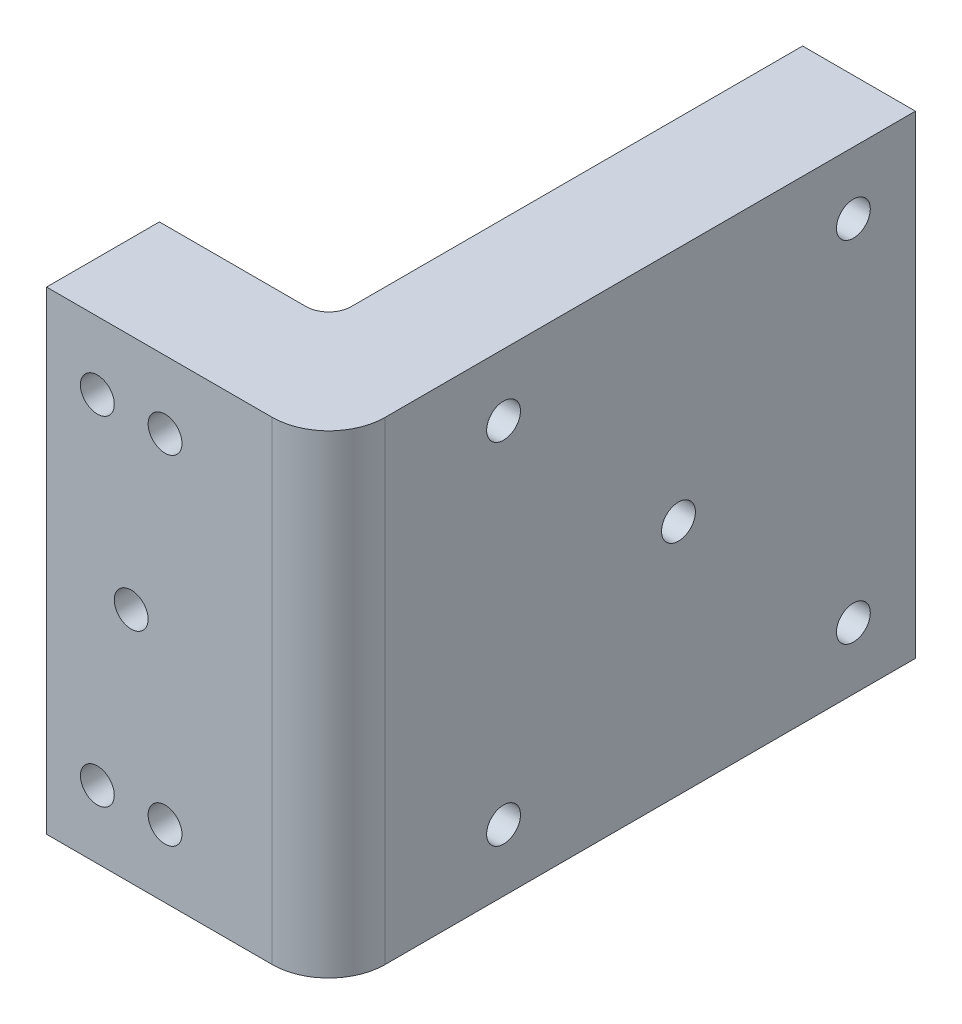
from build123d import *

# Parameters (mm, degrees)
SKETCH_1_W          = 15
SKETCH_1_H          = 42
SKETCH_1_R          = 1.5
SKETCH_1_W_2        = 10
EXTRUDE_1_DEPTH     = 10
SKETCH_2_W          = 10
SKETCH_2_H          = 42
EXTRUDE_2_DEPTH     = 42
SKETCH_3_R          = 1.5
CUT_EXTRUDE_1_DEPTH = 15
FILLET_1_R          = 2
FILLET_2_R          = 5


with BuildPart() as part:
    # 草图1 → 凸台-拉伸1 (new body)
    # profile 1 of 2: a face of its own
    with BuildSketch(Plane.XY):
        Rectangle(SKETCH_1_W, SKETCH_1_H)
        Circle(SKETCH_1_R, mode=Mode.SUBTRACT)
        with Locations((3, -15)):
            Circle(SKETCH_1_R, mode=Mode.SUBTRACT)
        with Locations((3, 15)):
            Circle(SKETCH_1_R, mode=Mode.SUBTRACT)
        with Locations((-3, -15)):
            Circle(SKETCH_1_R, mode=Mode.SUBTRACT)
        with Locations((-3, 15)):
            Circle(SKETCH_1_R, mode=Mode.SUBTRACT)
    # profile 2 of 2: a face of its own
    with BuildSketch(Plane.XY):
        with Locations((12.5, 0)):
            Rectangle(SKETCH_1_W_2, SKETCH_1_H)
    extrude(amount=EXTRUDE_1_DEPTH)

    # 草图2 → 凸台-拉伸2 (add)
    with BuildSketch(Plane(origin=(0, 0, 0), x_dir=(-1, 0, 0), z_dir=(0, 0, -1))):
        with Locations((-12.5, 0)):
            Rectangle(SKETCH_2_W, SKETCH_2_H)
    extrude(amount=EXTRUDE_2_DEPTH)

    # 草图3 → 切除-拉伸1 (cut)
    with BuildSketch(Plane.ZY.offset(-7.5)):
        with Locations(Location((-36.5, 15.5, 0), (0, 0, 270))):
            Circle(SKETCH_3_R)
        with Locations(Location((-5.5, 15.5, 0), (0, 0, 270))):
            Circle(SKETCH_3_R)
        with Locations(Location((-36.5, -15.5, 0), (0, 0, 270))):
            Circle(SKETCH_3_R)
        with Locations(Location((-5.5, -15.5, 0), (0, 0, 270))):
            Circle(SKETCH_3_R)
        with Locations(Location((-21, 0, 0), (0, 0, 270))):
            Circle(SKETCH_3_R)
    extrude(amount=-CUT_EXTRUDE_1_DEPTH, mode=Mode.SUBTRACT)

    # 圆角1
    fillet_1_edges = [part.edges().sort_by_distance(p)[0] for p in [
        (7.5, 0, 0),
    ]]
    fillet(fillet_1_edges, radius=FILLET_1_R)

    # 圆角2
    fillet_2_edges = [part.edges().sort_by_distance(p)[0] for p in [
        (17.5, 0, 10),
    ]]
    fillet(fillet_2_edges, radius=FILLET_2_R)


solid = part.part
